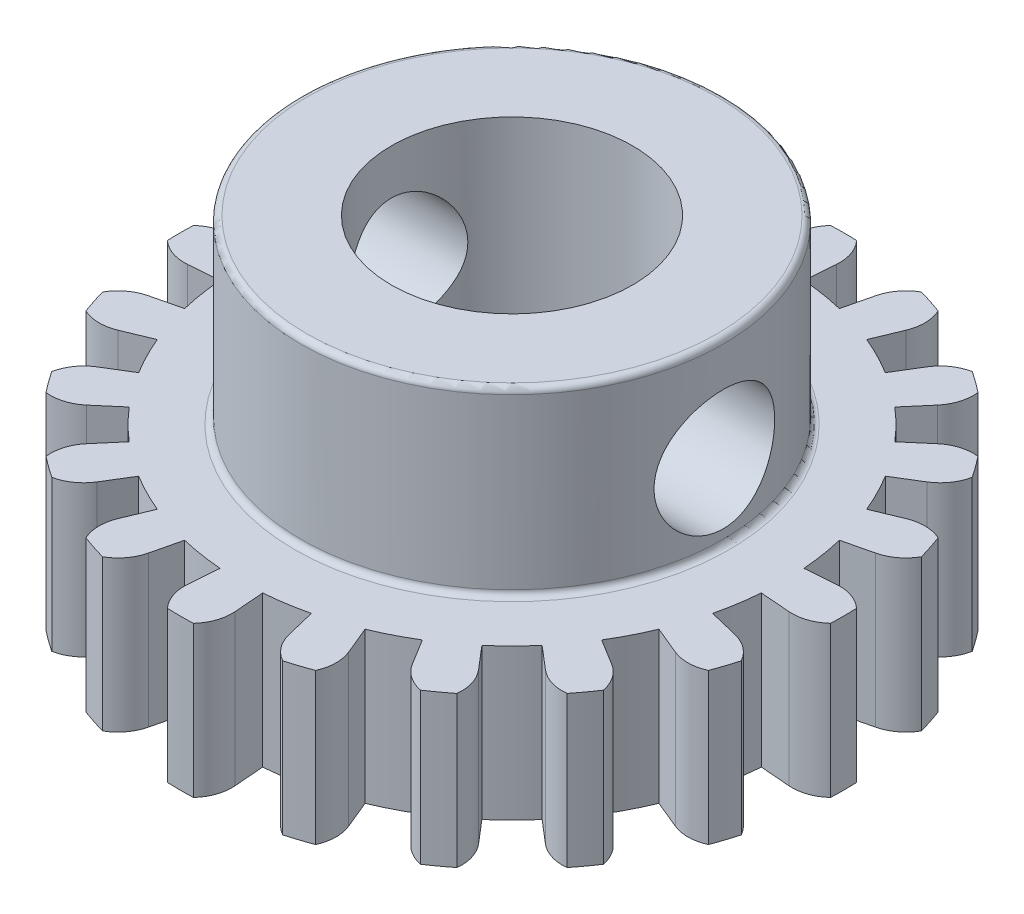
from build123d import *

# Parameters (mm, degrees)
BOSS_EXTRUDE1_DEPTH     = 5
CIRPATTERN1_COUNT       = 20
CUT_EXTRUDE1_DEPTH      = 17.340134638
CUT_EXTRUDE1_DEPTH_BACK = 17.340134638
SKETCH2_R               = 4
BOSS_EXTRUDE2_START     = 6
SKETCH2_3_R             = 7
SKETCH2_3_R_2           = 4
BOSS_EXTRUDE2_DEPTH     = 6
FILLET1_R               = 0.2
CUT_EXTRUDE2_DEPTH      = 20.052558883
CUT_EXTRUDE2_DEPTH_BACK = 20.052558883
SKETCH3_R               = 2


with BuildPart() as part:
    # Sketch1 → Boss-Extrude1 (new body)
    with BuildSketch(Plane(origin=(0, 0, 0), x_dir=(1, 0, 0), z_dir=(0, 1, 0))):
        with BuildLine():
            Line((8.972256004, 0.706131862), (9.969173337, 0.784590957))
            ThreePointArc((9.969173337, 0.784590957), (10.517087842, 0.714714369), (10.991519399, 0.431857973))
            ThreePointArc((10.991519399, 0.431857973), (11, 0), (10.991519399, -0.431857973))
            ThreePointArc((10.991519399, -0.431857973), (10.517087842, -0.714714369), (9.969173337, -0.784590957))
            Line((9.969173337, -0.784590957), (8.972256004, -0.706131862))
            ThreePointArc((8.972256004, -0.706131862), (8.937616113, -1.057836577), (8.889195065, -1.407910185))
            Line((8.889195065, -1.407910185), (0, 0))
            Line((0, 0), (8.889195065, 1.407910185))
            ThreePointArc((8.889195065, 1.407910185), (8.937616113, 1.057836577), (8.972256004, 0.706131862))
        make_face()
    boss_extrude1 = extrude(amount=BOSS_EXTRUDE1_DEPTH)

    # CirPattern1: Boss-Extrude1 ×20 about axis
    cirpattern1_axis = Axis((0, 5, 0), (0, -1, 0))
    for i in range(1, CIRPATTERN1_COUNT):
        add(boss_extrude1.rotate(cirpattern1_axis, i * 360 / CIRPATTERN1_COUNT))

    # Sketch2 → Cut-Extrude1 (cut, two sides: drawn at the far end of the back side and taken through both)
    with BuildSketch(Plane(origin=(0, 5, 0), x_dir=(1, 0, 0), z_dir=(0, 1, 0)).offset(-CUT_EXTRUDE1_DEPTH_BACK)):
        Circle(SKETCH2_R)
    extrude(amount=CUT_EXTRUDE1_DEPTH + CUT_EXTRUDE1_DEPTH_BACK, mode=Mode.SUBTRACT)

    # Sketch2<3> → Boss-Extrude2 (add)
    with BuildSketch(Plane(origin=(0, 5, 0), x_dir=(1, 0, 0), z_dir=(0, 1, 0)).offset(BOSS_EXTRUDE2_START)):
        Circle(SKETCH2_3_R)
        Circle(SKETCH2_3_R_2, mode=Mode.SUBTRACT)
    extrude(amount=-BOSS_EXTRUDE2_DEPTH)

    # Fillet1
    fillet1_edges = [part.edges().sort_by_distance(p)[0] for p in [
        (-7, 5, 0),
        (-7, 11, 0),
    ]]
    fillet(fillet1_edges, radius=FILLET1_R)

    # Sketch3 → Cut-Extrude2 (cut, two sides: drawn at the far end of the back side and taken through both)
    with BuildSketch(Plane(origin=(0, 0, 0), x_dir=(0, 0, -1), z_dir=(1, 0, 0)).offset(-CUT_EXTRUDE2_DEPTH_BACK)):
        with Locations((0, 7.5)):
            Circle(SKETCH3_R)
    extrude(amount=CUT_EXTRUDE2_DEPTH + CUT_EXTRUDE2_DEPTH_BACK, mode=Mode.SUBTRACT)


solid = part.part
